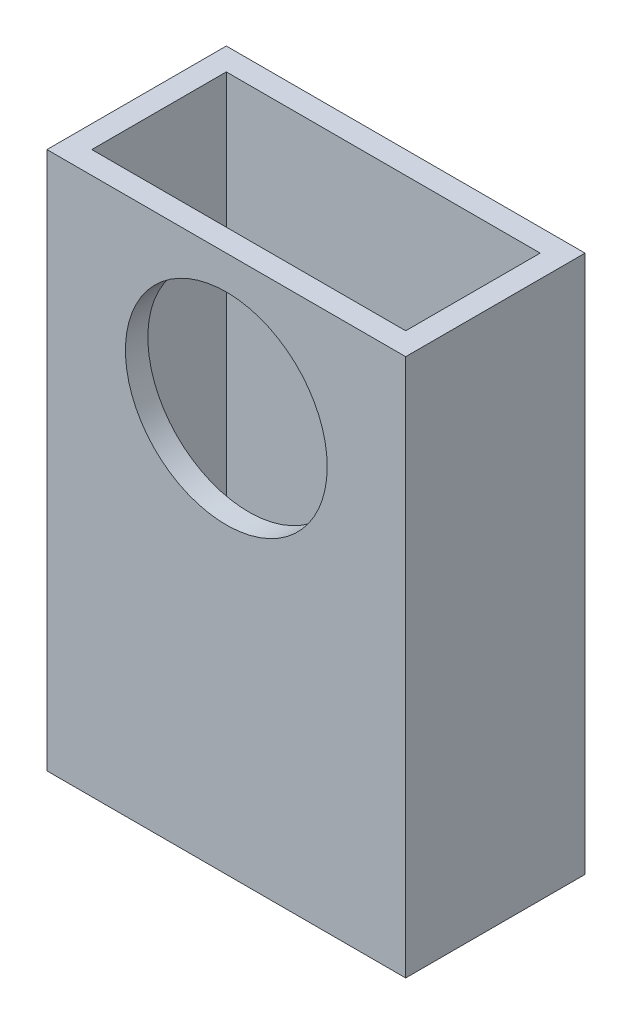
from build123d import *

# Parameters (mm, degrees)
SKETCH1_W           = 50.8
SKETCH1_H           = 76.2
BOSS_EXTRUDE1_DEPTH = 25.4
SKETCH2_W           = 44.45
SKETCH2_H           = 19.05
CUT_EXTRUDE1_DEPTH  = 96.038097624
SKETCH3_R           = 14.2875
CUT_EXTRUDE2_DEPTH  = 11.276680026


with BuildPart() as part:
    # Sketch1 → Boss-Extrude1 (new body)
    with BuildSketch(Plane.XY):
        with Locations((25.4, 38.1)):
            Rectangle(SKETCH1_W, SKETCH1_H)
    extrude(amount=BOSS_EXTRUDE1_DEPTH)

    # Sketch2 → Cut-Extrude1 (cut, through all)
    with BuildSketch(Plane.XZ):
        with Locations((25.4, 12.7)):
            Rectangle(SKETCH2_W, SKETCH2_H)
    extrude(amount=-CUT_EXTRUDE1_DEPTH, mode=Mode.SUBTRACT)

    # Sketch3 → Cut-Extrude2 (cut)
    with BuildSketch(Plane.XY.offset(25.4)):
        with Locations((25.4, 57.15)):
            Circle(SKETCH3_R)
    extrude(amount=-CUT_EXTRUDE2_DEPTH, mode=Mode.SUBTRACT)


solid = part.part
